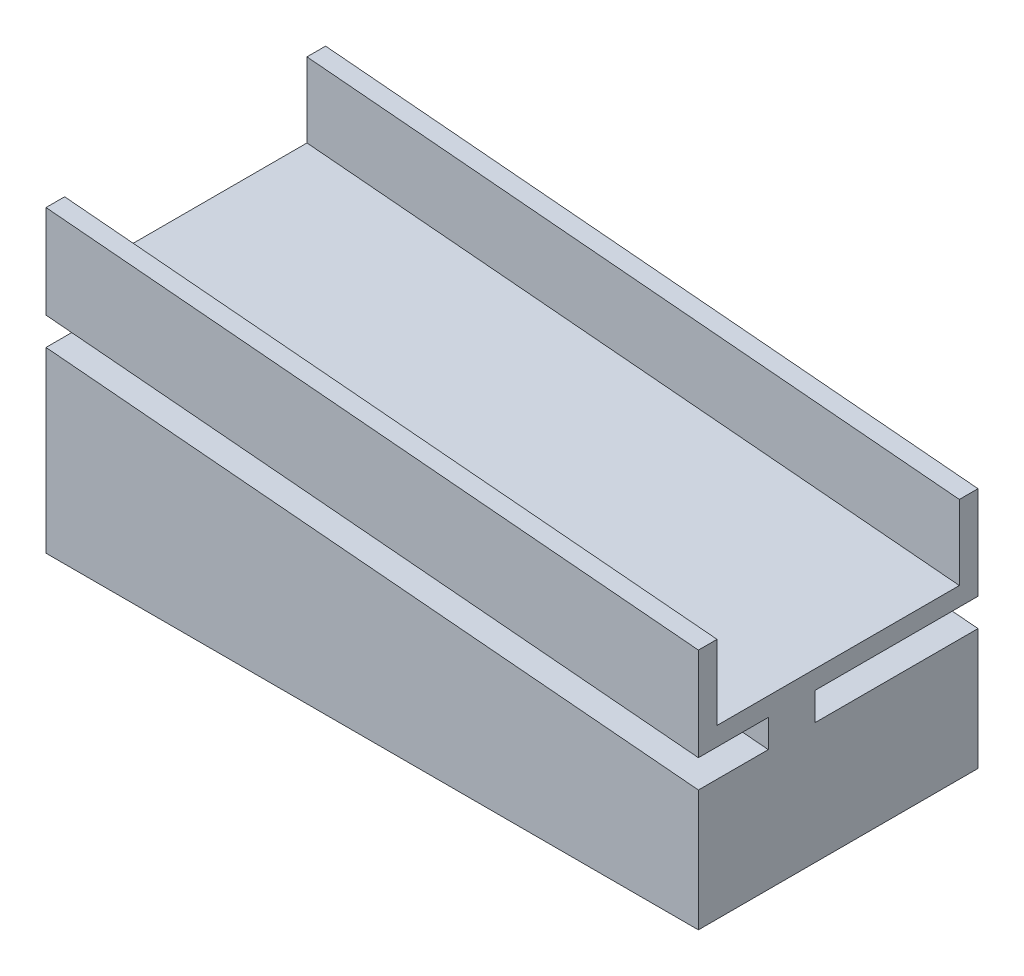
from build123d import *

# Parameters (mm, degrees)
SALIENTE_EXTRUIR1_DEPTH = 30
SALIENTE_EXTRUIR2_DEPTH = 2.5


with BuildPart() as part:
    # Croquis1 → Saliente-Extruir1 (new body)
    with BuildSketch(Plane.XY):
        Polygon((0, 0), (0, 19.124206447), (70, 13), (70, 0), align=None)
    extrude(amount=SALIENTE_EXTRUIR1_DEPTH)

    # Croquis3 → Saliente-Extruir2 (add, symmetric)
    with BuildSketch(Plane.XY.offset(20)):
        Polygon((0, 19.124206447), (70, 13), (70, 16), (0, 22.124206447), align=None)
    extrude(amount=SALIENTE_EXTRUIR2_DEPTH, both=True)

    # Barrer1: sweep along a path in Croquis4
    with BuildLine(Plane.XY.offset(20)) as barrer1_path:
        Line((0, 22.124206447), (70, 16))
    # Croquis5 → Barrer1 (sweep)
    with BuildSketch(Plane.ZY):
        Polygon((28, 32.124206447), (30, 32.124206447), (30, 22.124206447), (0, 22.124206447), (0, 32.124206447), (2, 32.124206447), (2, 24.124206447), (28, 24.124206447), align=None)
    sweep(path=barrer1_path.line)


solid = part.part
